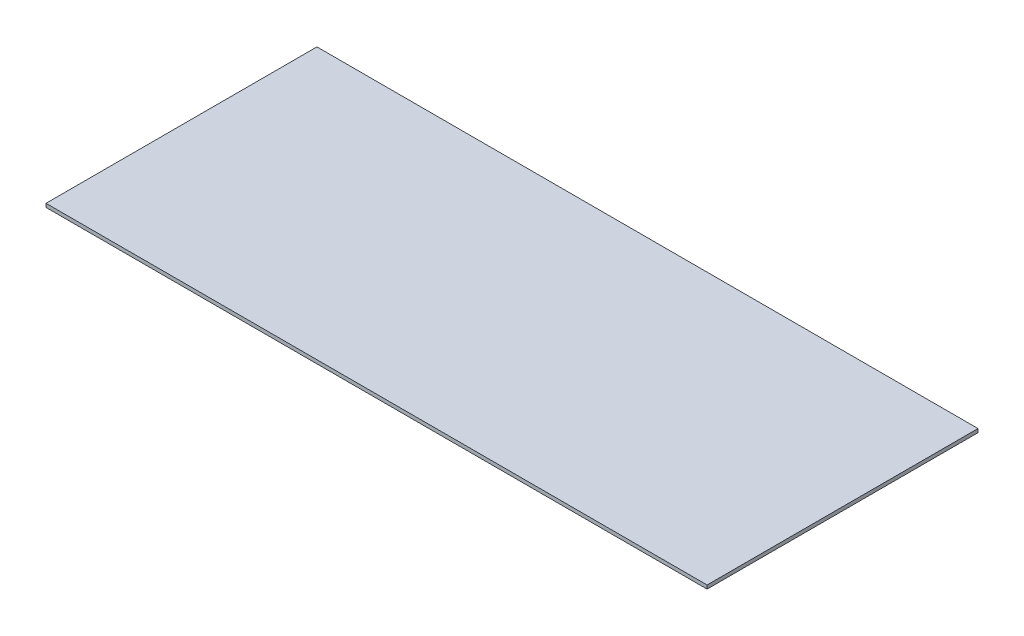
from build123d import *

# Parameters (mm, degrees)
SKETCH1_W           = 366
SKETCH1_H           = 150
BOSS_EXTRUDE1_DEPTH = 2


with BuildPart() as part:
    # Sketch1 → Boss-Extrude1 (new body)
    with BuildSketch(Plane(origin=(0, 0, 0), x_dir=(1, 0, 0), z_dir=(0, 1, 0))):
        Rectangle(SKETCH1_W, SKETCH1_H)
    extrude(amount=BOSS_EXTRUDE1_DEPTH)


solid = part.part
